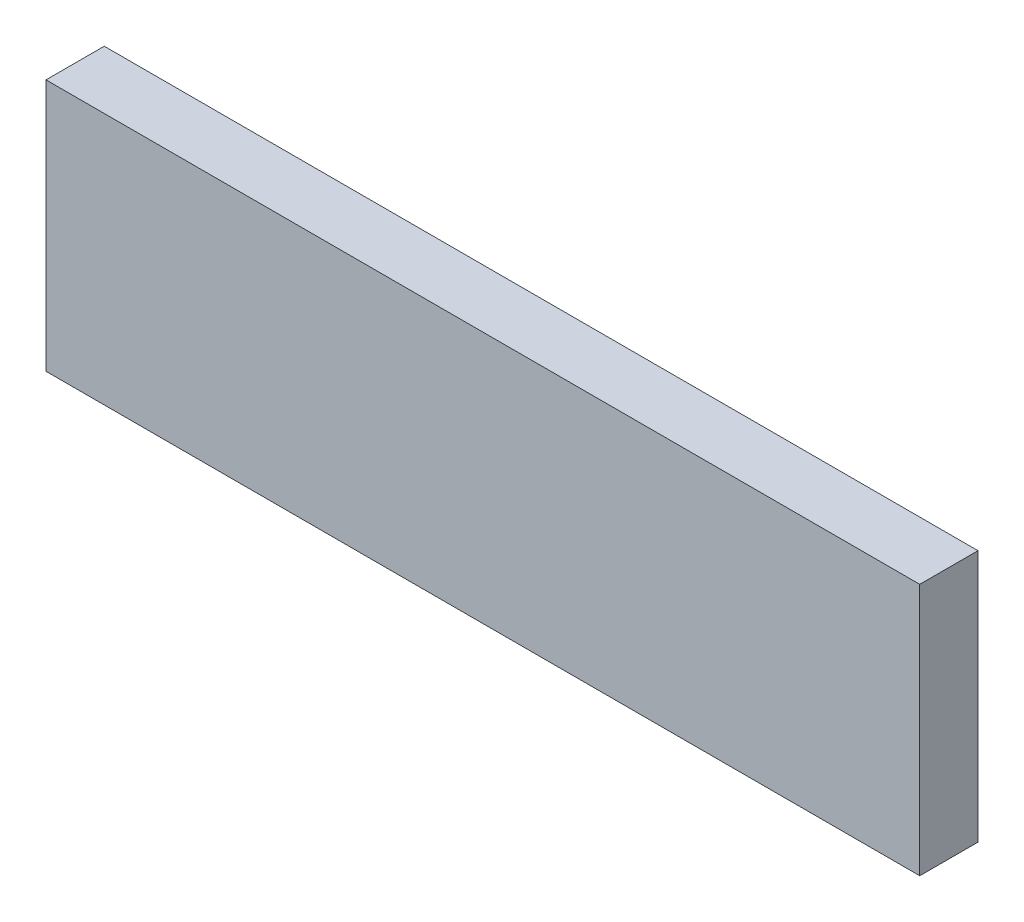
from build123d import *

# Parameters (mm, degrees)
SKETCH1_W           = 45
SKETCH1_H           = 13
BOSS_EXTRUDE1_DEPTH = 3


with BuildPart() as part:
    # Sketch1 → Boss-Extrude1 (new body)
    with BuildSketch(Plane.XY):
        with Locations((22.5, 6.5)):
            Rectangle(SKETCH1_W, SKETCH1_H)
    extrude(amount=BOSS_EXTRUDE1_DEPTH)


solid = part.part
